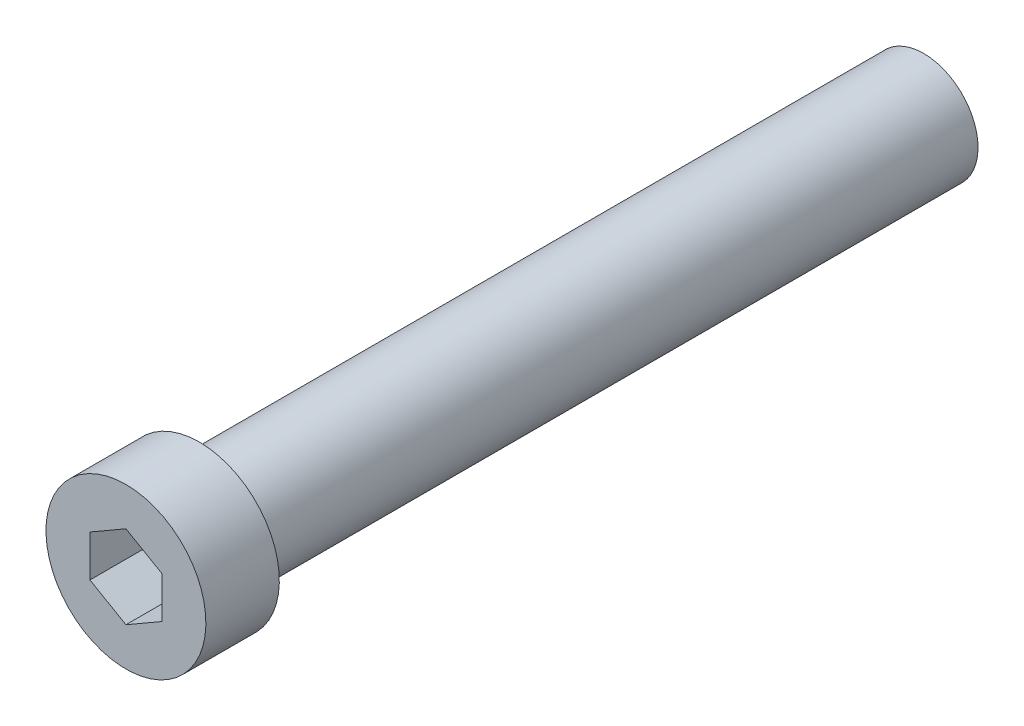
from build123d import *

# Parameters (mm, degrees)
SKETCH_1_W          = 2.208
SKETCH_1_H          = 2.028
SKETCH_2_R          = 1.5
EXTRUDE_1_DEPTH     = 20
CUT_EXTRUDE_1_DEPTH = 1.872


with BuildPart() as part:
    # 草图1 → 旋转1 (revolve)
    with BuildSketch(Plane.XZ, mode=Mode.PRIVATE) as revolve_1_sk:
        with Locations((1.104, 1.014)):
            Rectangle(SKETCH_1_W, SKETCH_1_H)
    revolve(revolve_1_sk.sketch.rotate(Axis((0, 0, 2.028), (0, 0, -1)), 270), axis=Axis((0, 0, 2.028), (0, 0, -1)))

    # 草图2 → 凸台-拉伸1 (add)
    with BuildSketch(Plane(origin=(0, 0, 0), x_dir=(-1, 0, 0), z_dir=(0, 0, -1))):
        with Locations(Location((0, 0, 0), (0, 0, 90))):
            Circle(SKETCH_2_R)
    extrude(amount=EXTRUDE_1_DEPTH)

    # 草图3 → 切除-拉伸1 (cut)
    with BuildSketch(Plane.XY.offset(2.028)):
        Polygon((0.9936, -0.573655227), (0.9936, 0.573655227), (0, 1.147310455), (-0.9936, 0.573655227), (-0.9936, -0.573655227), (0, -1.147310455), align=None)
    extrude(amount=-CUT_EXTRUDE_1_DEPTH, mode=Mode.SUBTRACT)


solid = part.part
